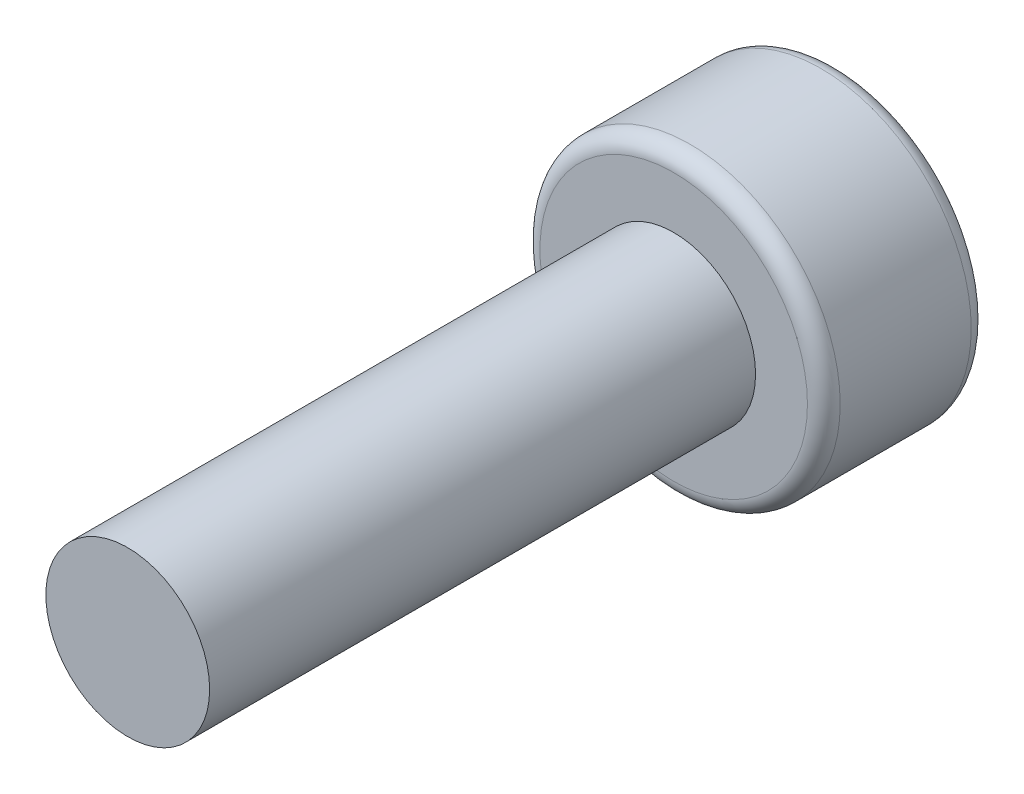
from build123d import *

# Parameters (mm, degrees)
SKETCH_1_R          = 2.75
EXTRUDE_1_DEPTH     = 3
SKETCH_2_R          = 1.5
EXTRUDE_2_DEPTH     = 10
FILLET_1_R          = 0.3
CUT_EXTRUDE_1_DEPTH = 2


with BuildPart() as part:
    # 草图1 → 凸台-拉伸1 (new body)
    with BuildSketch(Plane.XY):
        Circle(SKETCH_1_R)
    extrude(amount=EXTRUDE_1_DEPTH)

    # 草图2 → 凸台-拉伸2 (add)
    with BuildSketch(Plane.XY.offset(3)):
        Circle(SKETCH_2_R)
    extrude(amount=EXTRUDE_2_DEPTH)

    # 圆角1
    fillet_1_edges = [part.edges().sort_by_distance(p)[0] for p in [
        (-2.75, 0, 0),
        (-2.75, 0, 3),
    ]]
    fillet(fillet_1_edges, radius=FILLET_1_R)

    # 草图3 → 切除-拉伸1 (cut)
    with BuildSketch(Plane(origin=(0, 0, 0), x_dir=(-1, 0, 0), z_dir=(0, 0, -1))):
        Polygon((-0.820853493, 1.862408161), (-2.023319526, 0.220324103), (-1.202466033, -1.642084058), (0.820853493, -1.862408161), (2.023319526, -0.220324103), (1.202466033, 1.642084058), align=None)
    extrude(amount=-CUT_EXTRUDE_1_DEPTH, mode=Mode.SUBTRACT)


solid = part.part
